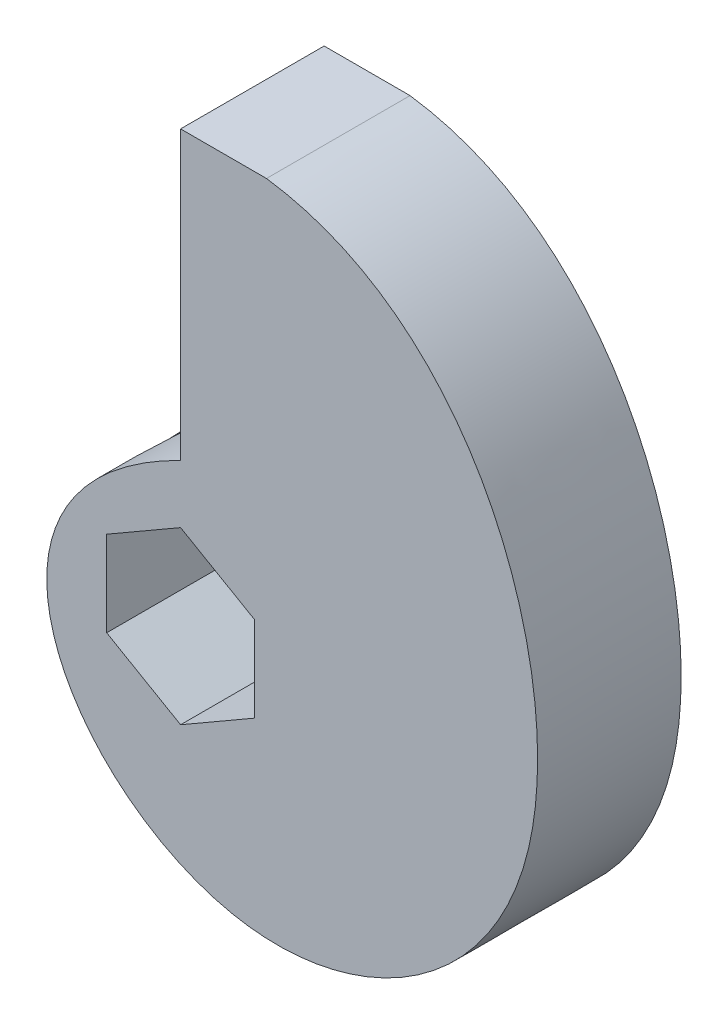
from build123d import *

# Parameters (mm, degrees)
BOSS_EXTRUDE1_DEPTH = 12.7
CUT_EXTRUDE1_DEPTH  = 52.093515348


with BuildPart() as part:
    # Sketch1 → Boss-Extrude1 (new body)
    with BuildSketch(Plane.XY):
        with BuildLine():
            Line((0, 38.1), (0, 12.7))
            add(Edge.make_bspline(
                [(7.599767601, 38.1), (26.246073074, 35.529347142), (41.164337366, -6.756573634), (-0.46828552, -31.547387173), (-21.773032453, 1.949257827), (0, 12.7)],
                knots=[0.037945328, 0.037945328, 0.037945328, 0.037945328, 0.338030766, 0.620420862, 1, 1, 1, 1], degree=3))
            Line((7.599767601, 38.1), (0, 38.1))
        make_face()
        with BuildLine():
            ThreePointArc((3.175, 0), (-2.24506403, -2.24506403), (0, 3.175))
            ThreePointArc((0, 3.175), (2.24506403, 2.24506403), (3.175, 0))
        make_face(mode=Mode.SUBTRACT)
    extrude(amount=BOSS_EXTRUDE1_DEPTH)

    # Sketch2 → Cut-Extrude1 (cut, through all)
    with BuildSketch(Plane.XY.offset(12.7)):
        Polygon((6.5405, -3.776159436), (6.5405, 3.776159436), (0, 7.552318871), (-6.5405, 3.776159436), (-6.5405, -3.776159436), (0, -7.552318871), align=None)
    extrude(amount=-CUT_EXTRUDE1_DEPTH, mode=Mode.SUBTRACT)


solid = part.part
